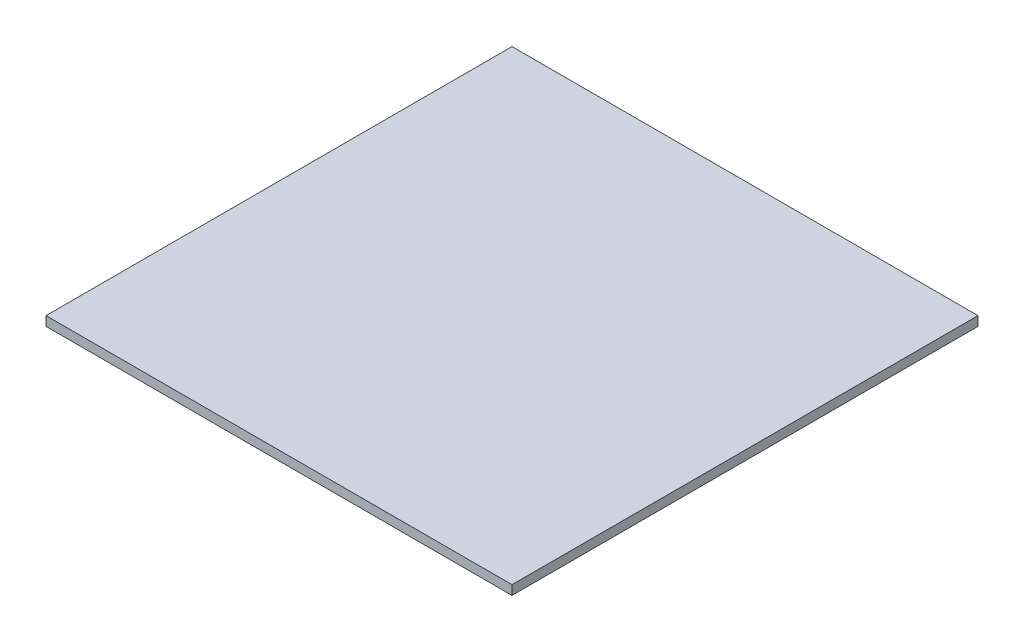
from build123d import *

# Parameters (mm, degrees)
CROQUIS1_W              = 100
CROQUIS1_H              = 100
SALIENTE_EXTRUIR1_DEPTH = 2


with BuildPart() as part:
    # Croquis1 → Saliente-Extruir1 (new body)
    with BuildSketch(Plane(origin=(0, 0, 0), x_dir=(1, 0, 0), z_dir=(0, 1, 0))):
        with Locations((50, 50)):
            Rectangle(CROQUIS1_W, CROQUIS1_H)
    extrude(amount=SALIENTE_EXTRUIR1_DEPTH)


solid = part.part
